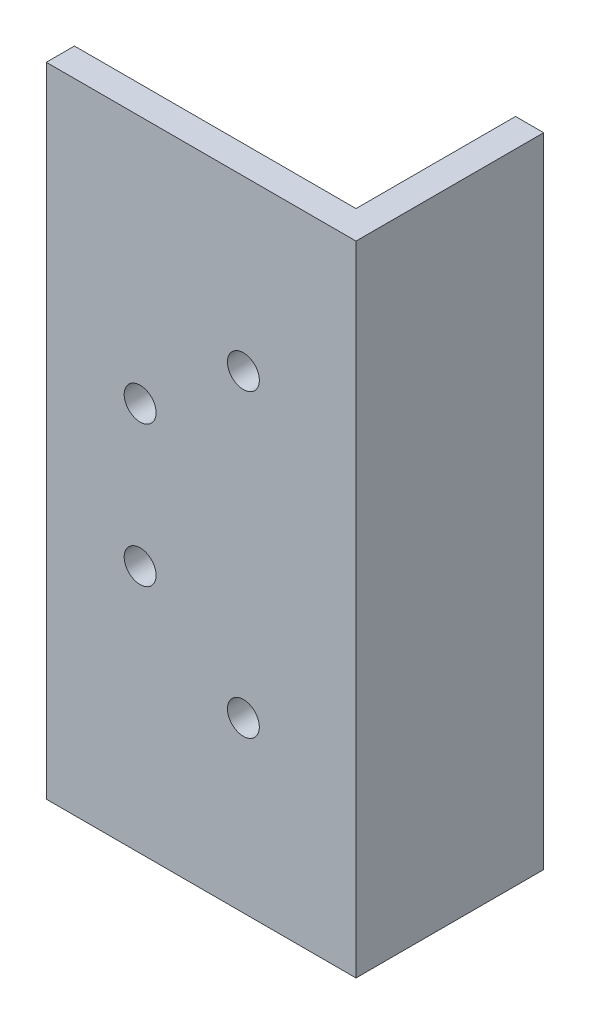
from build123d import *

# Parameters (mm, degrees)
SKETCH_1_W          = 30
SKETCH_1_H          = 3
EXTRUDE_1_DEPTH     = 68
CUT_EXTRUDE_1_REACH = 80.186
SKETCH_2_R          = 1.7


with BuildPart() as part:
    # 草图1 → 凸台-拉伸1 (new body)
    with BuildSketch(Plane(origin=(0, 0, 0), x_dir=(1, 0, 0), z_dir=(0, 1, 0))):
        with Locations((15, 1.5)):
            Rectangle(SKETCH_1_W, SKETCH_1_H)
        Polygon((33, 20), (30, 20), (30, 3), (30, 0), (33, 0), align=None)
    extrude(amount=EXTRUDE_1_DEPTH)

    # 草图2 → 切除-拉伸1 (cut, up to next)
    with BuildSketch(Plane.XY, mode=Mode.PRIVATE) as cut_extrude_1_sk1:
        with Locations((21, 18)):
            Circle(SKETCH_2_R)
    cut_extrude_1_tool1 = extrude(cut_extrude_1_sk1.sketch, amount=-CUT_EXTRUDE_1_REACH, mode=Mode.PRIVATE) & part.part
    # 草图2 → 切除-拉伸1 (cut, up to next)
    with BuildSketch(Plane.XY, mode=Mode.PRIVATE) as cut_extrude_1_sk2:
        with Locations((21, 50)):
            Circle(SKETCH_2_R)
    cut_extrude_1_tool2 = extrude(cut_extrude_1_sk2.sketch, amount=-CUT_EXTRUDE_1_REACH, mode=Mode.PRIVATE) & part.part
    # 草图2 → 切除-拉伸1 (cut, up to next)
    with BuildSketch(Plane.XY, mode=Mode.PRIVATE) as cut_extrude_1_sk3:
        with Locations((10, 26.5)):
            Circle(SKETCH_2_R)
    cut_extrude_1_tool3 = extrude(cut_extrude_1_sk3.sketch, amount=-CUT_EXTRUDE_1_REACH, mode=Mode.PRIVATE) & part.part
    # 草图2 → 切除-拉伸1 (cut, up to next)
    with BuildSketch(Plane.XY, mode=Mode.PRIVATE) as cut_extrude_1_sk4:
        with Locations((10, 41.5)):
            Circle(SKETCH_2_R)
    cut_extrude_1_tool4 = extrude(cut_extrude_1_sk4.sketch, amount=-CUT_EXTRUDE_1_REACH, mode=Mode.PRIVATE) & part.part
    add(cut_extrude_1_tool1.solids().sort_by_distance((21, 18, 0))[0], mode=Mode.SUBTRACT)
    add(cut_extrude_1_tool2.solids().sort_by_distance((21, 50, 0))[0], mode=Mode.SUBTRACT)
    add(cut_extrude_1_tool3.solids().sort_by_distance((10, 26.5, 0))[0], mode=Mode.SUBTRACT)
    add(cut_extrude_1_tool4.solids().sort_by_distance((10, 41.5, 0))[0], mode=Mode.SUBTRACT)


solid = part.part
